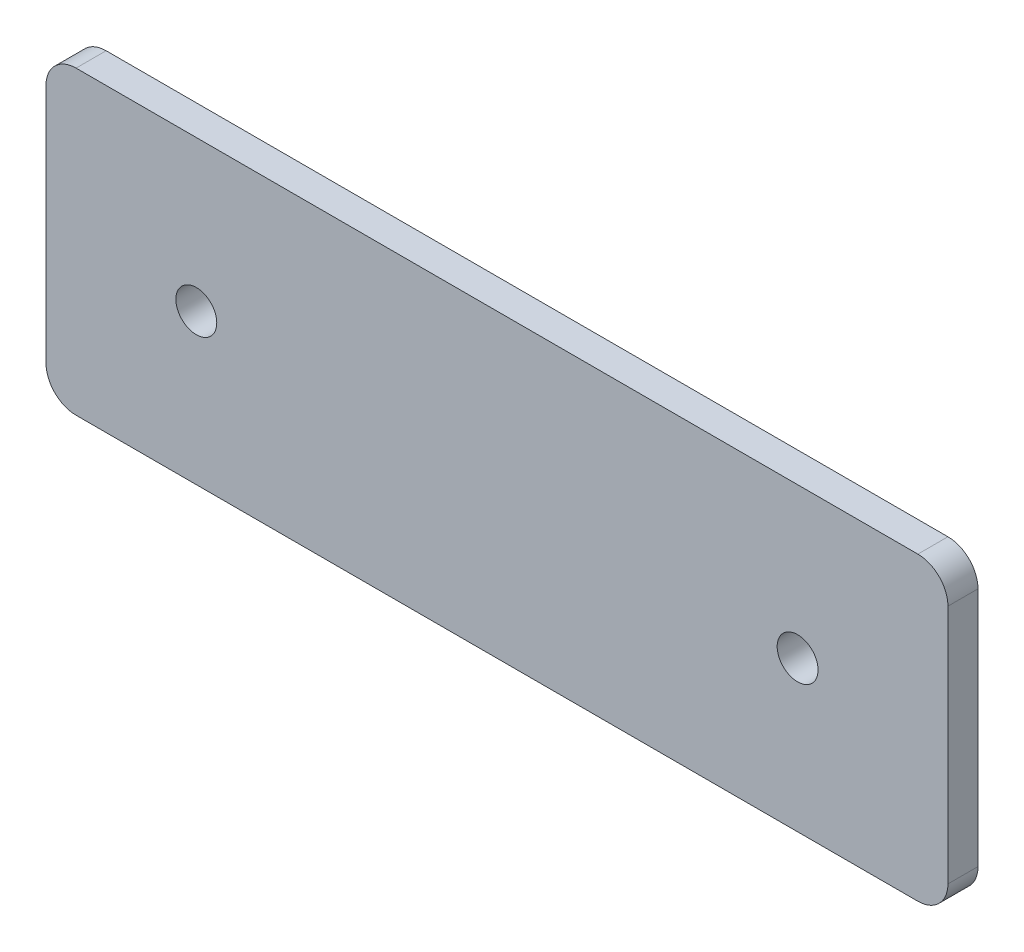
from build123d import *

# Parameters (mm, degrees)
EXTRUDE_1_DEPTH    = 5
HOLE_WIZARD_M8_2_D = 6.8


with BuildPart() as part:
    # 草图1 → 凸台-拉伸1 (new body)
    with BuildSketch(Plane.XY):
        with BuildLine():
            Line((-70, 25), (70, 25))
            ThreePointArc((70, 25), (73.535533906, 23.535533906), (75, 20))
            Line((75, 20), (75, -20))
            ThreePointArc((75, -20), (73.535533906, -23.535533906), (70, -25))
            Line((70, -25), (-70, -25))
            ThreePointArc((-70, -25), (-73.535533906, -23.535533906), (-75, -20))
            Line((-75, -20), (-75, 20))
            ThreePointArc((-75, 20), (-73.535533906, 23.535533906), (-70, 25))
        make_face()
    extrude(amount=EXTRUDE_1_DEPTH)

    # M8 螺纹槽口的螺纹槽口钻头2 (through all)
    with Locations(Plane.XY.offset(5)):
        with Locations((-50, 0), (50, 0)):
            Hole(HOLE_WIZARD_M8_2_D / 2)


solid = part.part
